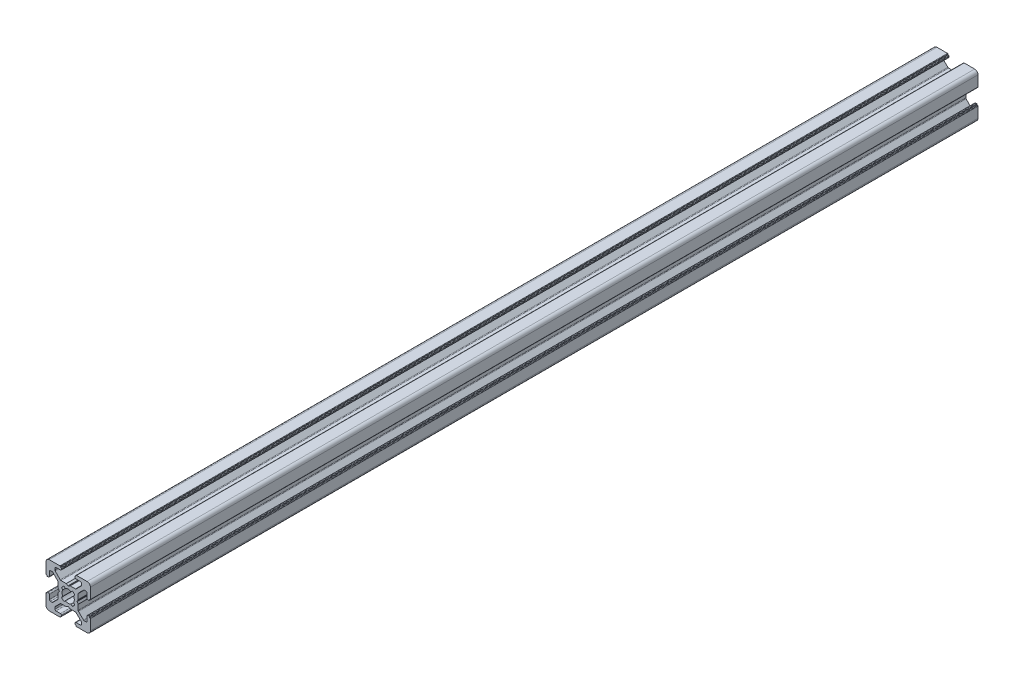
from build123d import *

# Parameters (mm, degrees)
EXTRUDE1_DEPTH = 400


with BuildPart() as part:
    # Sketch1 → Extrude1 (new body)
    with BuildSketch(Plane.XY):
        with BuildLine():
            Line((-3.5, 8.499999673), (-5.500000686, 8.499999673))
            ThreePointArc((-5.500000686, 8.499999673), (-5.853554077, 8.353553064), (-6.000000686, 7.999999673))
            Line((-6.000000686, 7.999999673), (-6.000000686, 7.267766626))
            ThreePointArc((-6.000000686, 7.267766626), (-5.961940448, 7.076424899), (-5.853554059, 6.914213219))
            Line((-5.853554059, 6.914213219), (-3.585787212, 4.646446592))
            ThreePointArc((-3.585787212, 4.646446592), (-3.423575544, 4.538060229), (-3.232233839, 4.5))
            Line((-3.232233839, 4.5), (-0.953590312, 4.5))
            ThreePointArc((-0.953590312, 4.5), (-0.901826505, 4.493185166), (-0.853590316, 4.473205083))
            Line((-0.853590316, 4.473205083), (-0.100000045, 4.038119562))
            ThreePointArc((-0.100000045, 4.038119562), (0, 4.011324632), (0.100000045, 4.038119562))
            Line((0.100000045, 4.038119562), (0.853590316, 4.473205083))
            ThreePointArc((0.853590316, 4.473205083), (0.901826505, 4.493185166), (0.953590312, 4.5))
            Line((0.953590312, 4.5), (3.232233839, 4.5))
            ThreePointArc((3.232233839, 4.5), (3.423575544, 4.538060229), (3.585787212, 4.646446592))
            Line((3.585787212, 4.646446592), (5.853554059, 6.914213219))
            ThreePointArc((5.853554059, 6.914213219), (5.961940448, 7.076424899), (6.000000686, 7.267766626))
            Line((6.000000686, 7.267766626), (6.000000686, 7.999999673))
            ThreePointArc((6.000000686, 7.999999673), (5.853554077, 8.353553064), (5.500000686, 8.499999673))
            Line((5.500000686, 8.499999673), (3.5, 8.499999673))
            ThreePointArc((3.5, 8.499999673), (3.146446609, 8.646446283), (3, 8.999999673))
            Line((3, 8.999999673), (3, 9.3))
            ThreePointArc((3, 9.3), (3.058578644, 9.441421356), (3.2, 9.5))
            Line((3.2, 9.5), (3.350000228, 9.5))
            ThreePointArc((3.350000228, 9.5), (3.491421584, 9.558578644), (3.550000228, 9.7))
            Line((3.550000228, 9.7), (3.550000228, 9.8))
            ThreePointArc((3.550000228, 9.8), (3.608578871, 9.941421356), (3.750000228, 10))
            Line((3.750000228, 10), (8.5, 10))
            ThreePointArc((8.5, 10), (9.560660172, 9.560660172), (10, 8.5))
            Line((10, 8.5), (10, 3.749999605))
            ThreePointArc((10, 3.749999605), (9.941421356, 3.608578248), (9.8, 3.549999605))
            Line((9.8, 3.549999605), (9.699999732, 3.549999605))
            ThreePointArc((9.699999732, 3.549999605), (9.558578376, 3.491420961), (9.499999732, 3.349999605))
            Line((9.499999732, 3.349999605), (9.499999732, 3.2))
            ThreePointArc((9.499999732, 3.2), (9.441421088, 3.058578644), (9.299999732, 3))
            Line((9.299999732, 3), (8.999999732, 3))
            ThreePointArc((8.999999732, 3), (8.646446341, 3.146446609), (8.499999732, 3.5))
            Line((8.499999732, 3.5), (8.499999732, 5.499999605))
            ThreePointArc((8.499999732, 5.499999605), (8.353553123, 5.853552995), (7.999999732, 5.999999605))
            Line((7.999999732, 5.999999605), (7.267766685, 5.999999605))
            ThreePointArc((7.267766685, 5.999999605), (7.076424969, 5.961939371), (6.914213294, 5.853552995))
            Line((6.914213294, 5.853552995), (4.646446398, 3.585786099))
            ThreePointArc((4.646446398, 3.585786099), (4.538060023, 3.423574425), (4.499999789, 3.232232708))
            Line((4.499999789, 3.232232708), (4.499999789, 0.953589302))
            ThreePointArc((4.499999789, 0.953589302), (4.493184953, 0.90182549), (4.473204867, 0.853589297))
            Line((4.473204867, 0.853589297), (4.038119841, 0.099999969))
            ThreePointArc((4.038119841, 0.099999969), (4.011324929, 0), (4.038119841, -0.099999969))
            Line((4.038119841, -0.099999969), (4.473204867, -0.853589297))
            ThreePointArc((4.473204867, -0.853589297), (4.493184953, -0.90182549), (4.499999789, -0.953589302))
            Line((4.499999789, -0.953589302), (4.499999789, -3.232232708))
            ThreePointArc((4.499999789, -3.232232708), (4.538060023, -3.423574425), (4.646446398, -3.585786099))
            Line((4.646446398, -3.585786099), (6.914213294, -5.853552995))
            ThreePointArc((6.914213294, -5.853552995), (7.076424969, -5.961939371), (7.267766685, -5.999999605))
            Line((7.267766685, -5.999999605), (7.999999732, -5.999999605))
            ThreePointArc((7.999999732, -5.999999605), (8.353553123, -5.853552995), (8.499999732, -5.499999605))
            Line((8.499999732, -5.499999605), (8.499999732, -3.5))
            ThreePointArc((8.499999732, -3.5), (8.646446341, -3.146446609), (8.999999732, -3))
            Line((8.999999732, -3), (9.299999732, -3))
            ThreePointArc((9.299999732, -3), (9.441421088, -3.058578644), (9.499999732, -3.2))
            Line((9.499999732, -3.2), (9.499999732, -3.349999605))
            ThreePointArc((9.499999732, -3.349999605), (9.558578376, -3.491420961), (9.699999732, -3.549999605))
            Line((9.699999732, -3.549999605), (9.8, -3.549999605))
            ThreePointArc((9.8, -3.549999605), (9.941421356, -3.608578248), (10, -3.749999605))
            Line((10, -3.749999605), (10, -8.5))
            ThreePointArc((10, -8.5), (9.560660172, -9.560660172), (8.5, -10))
            Line((8.5, -10), (3.750000228, -10))
            ThreePointArc((3.750000228, -10), (3.608578871, -9.941421356), (3.550000228, -9.8))
            Line((3.550000228, -9.8), (3.550000228, -9.7))
            ThreePointArc((3.550000228, -9.7), (3.491421584, -9.558578644), (3.350000228, -9.5))
            Line((3.350000228, -9.5), (3.2, -9.5))
            ThreePointArc((3.2, -9.5), (3.058578644, -9.441421356), (3, -9.3))
            Line((3, -9.3), (3, -8.999999673))
            ThreePointArc((3, -8.999999673), (3.146446609, -8.646446283), (3.5, -8.499999673))
            Line((3.5, -8.499999673), (5.500000686, -8.499999673))
            ThreePointArc((5.500000686, -8.499999673), (5.853554077, -8.353553064), (6.000000686, -7.999999673))
            Line((6.000000686, -7.999999673), (6.000000686, -7.267766626))
            ThreePointArc((6.000000686, -7.267766626), (5.961940448, -7.076424899), (5.853554059, -6.914213219))
            Line((5.853554059, -6.914213219), (3.585787212, -4.646446592))
            ThreePointArc((3.585787212, -4.646446592), (3.423575544, -4.538060229), (3.232233839, -4.5))
            Line((3.232233839, -4.5), (0.953590312, -4.5))
            ThreePointArc((0.953590312, -4.5), (0.901826505, -4.493185166), (0.853590316, -4.473205083))
            Line((0.853590316, -4.473205083), (0.100000045, -4.038119562))
            ThreePointArc((0.100000045, -4.038119562), (0, -4.011324632), (-0.100000045, -4.038119562))
            Line((-0.100000045, -4.038119562), (-0.853590316, -4.473205083))
            ThreePointArc((-0.853590316, -4.473205083), (-0.901826505, -4.493185166), (-0.953590312, -4.5))
            Line((-0.953590312, -4.5), (-3.232233839, -4.5))
            ThreePointArc((-3.232233839, -4.5), (-3.423575544, -4.538060229), (-3.585787212, -4.646446592))
            Line((-3.585787212, -4.646446592), (-5.853554059, -6.914213219))
            ThreePointArc((-5.853554059, -6.914213219), (-5.961940448, -7.076424899), (-6.000000686, -7.267766626))
            Line((-6.000000686, -7.267766626), (-6.000000686, -7.999999673))
            ThreePointArc((-6.000000686, -7.999999673), (-5.853554077, -8.353553064), (-5.500000686, -8.499999673))
            Line((-5.500000686, -8.499999673), (-3.5, -8.499999673))
            ThreePointArc((-3.5, -8.499999673), (-3.146446609, -8.646446283), (-3, -8.999999673))
            Line((-3, -8.999999673), (-3, -9.3))
            ThreePointArc((-3, -9.3), (-3.058578644, -9.441421356), (-3.2, -9.5))
            Line((-3.2, -9.5), (-3.350000228, -9.5))
            ThreePointArc((-3.350000228, -9.5), (-3.491421584, -9.558578644), (-3.550000228, -9.7))
            Line((-3.550000228, -9.7), (-3.550000228, -9.8))
            ThreePointArc((-3.550000228, -9.8), (-3.608578871, -9.941421356), (-3.750000228, -10))
            Line((-3.750000228, -10), (-8.5, -10))
            ThreePointArc((-8.5, -10), (-9.560660172, -9.560660172), (-10, -8.5))
            Line((-10, -8.5), (-10, -3.749999605))
            ThreePointArc((-10, -3.749999605), (-9.941421356, -3.608578248), (-9.8, -3.549999605))
            Line((-9.8, -3.549999605), (-9.699999732, -3.549999605))
            ThreePointArc((-9.699999732, -3.549999605), (-9.558578376, -3.491420961), (-9.499999732, -3.349999605))
            Line((-9.499999732, -3.349999605), (-9.499999732, -3.2))
            ThreePointArc((-9.499999732, -3.2), (-9.441421088, -3.058578644), (-9.299999732, -3))
            Line((-9.299999732, -3), (-8.999999732, -3))
            ThreePointArc((-8.999999732, -3), (-8.646446341, -3.146446609), (-8.499999732, -3.5))
            Line((-8.499999732, -3.5), (-8.499999732, -5.499999605))
            ThreePointArc((-8.499999732, -5.499999605), (-8.353553123, -5.853552995), (-7.999999732, -5.999999605))
            Line((-7.999999732, -5.999999605), (-7.267766685, -5.999999605))
            ThreePointArc((-7.267766685, -5.999999605), (-7.076424969, -5.961939371), (-6.914213294, -5.853552995))
            Line((-6.914213294, -5.853552995), (-4.646446398, -3.585786099))
            ThreePointArc((-4.646446398, -3.585786099), (-4.538060023, -3.423574425), (-4.499999789, -3.232232708))
            Line((-4.499999789, -3.232232708), (-4.499999789, -0.953589302))
            ThreePointArc((-4.499999789, -0.953589302), (-4.493184953, -0.90182549), (-4.473204867, -0.853589297))
            Line((-4.473204867, -0.853589297), (-4.038119841, -0.099999969))
            ThreePointArc((-4.038119841, -0.099999969), (-4.011324929, 0), (-4.038119841, 0.099999969))
            Line((-4.038119841, 0.099999969), (-4.473204867, 0.853589297))
            ThreePointArc((-4.473204867, 0.853589297), (-4.493184953, 0.90182549), (-4.499999789, 0.953589302))
            Line((-4.499999789, 0.953589302), (-4.499999789, 3.232232708))
            ThreePointArc((-4.499999789, 3.232232708), (-4.538060023, 3.423574425), (-4.646446398, 3.585786099))
            Line((-4.646446398, 3.585786099), (-6.914213294, 5.853552995))
            ThreePointArc((-6.914213294, 5.853552995), (-7.076424969, 5.961939371), (-7.267766685, 5.999999605))
            Line((-7.267766685, 5.999999605), (-7.999999732, 5.999999605))
            ThreePointArc((-7.999999732, 5.999999605), (-8.353553123, 5.853552995), (-8.499999732, 5.499999605))
            Line((-8.499999732, 5.499999605), (-8.499999732, 3.5))
            ThreePointArc((-8.499999732, 3.5), (-8.646446341, 3.146446609), (-8.999999732, 3))
            Line((-8.999999732, 3), (-9.299999732, 3))
            ThreePointArc((-9.299999732, 3), (-9.441421088, 3.058578644), (-9.499999732, 3.2))
            Line((-9.499999732, 3.2), (-9.499999732, 3.349999605))
            ThreePointArc((-9.499999732, 3.349999605), (-9.558578376, 3.491420961), (-9.699999732, 3.549999605))
            Line((-9.699999732, 3.549999605), (-9.8, 3.549999605))
            ThreePointArc((-9.8, 3.549999605), (-9.941421356, 3.608578248), (-10, 3.749999605))
            Line((-10, 3.749999605), (-10, 8.5))
            ThreePointArc((-10, 8.5), (-9.560660172, 9.560660172), (-8.5, 10))
            Line((-8.5, 10), (-3.750000228, 10))
            ThreePointArc((-3.750000228, 10), (-3.608578871, 9.941421356), (-3.550000228, 9.8))
            Line((-3.550000228, 9.8), (-3.550000228, 9.7))
            ThreePointArc((-3.550000228, 9.7), (-3.491421584, 9.558578644), (-3.350000228, 9.5))
            Line((-3.350000228, 9.5), (-3.2, 9.5))
            ThreePointArc((-3.2, 9.5), (-3.058578644, 9.441421356), (-3, 9.3))
            Line((-3, 9.3), (-3, 8.999999673))
            ThreePointArc((-3, 8.999999673), (-3.146446609, 8.646446283), (-3.5, 8.499999673))
        make_face()
        with BuildLine():
            Line((-1.258185436, 2.445295362), (-1.91389502, 2.989640962))
            ThreePointArc((-1.91389502, 2.989640962), (-2.511737261, 2.508410485), (-2.992174953, 1.909930962))
            Line((-2.992174953, 1.909930962), (-2.445295423, 1.258185317))
            ThreePointArc((-2.445295423, 1.258185317), (-2.75, 0), (-2.445295423, -1.258185317))
            Line((-2.445295423, -1.258185317), (-2.992174953, -1.909930962))
            ThreePointArc((-2.992174953, -1.909930962), (-2.511737261, -2.508410485), (-1.91389502, -2.989640962))
            Line((-1.91389502, -2.989640962), (-1.258185436, -2.445295362))
            ThreePointArc((-1.258185436, -2.445295362), (0, -2.75), (1.258185436, -2.445295362))
            Line((1.258185436, -2.445295362), (1.91389502, -2.989640962))
            ThreePointArc((1.91389502, -2.989640962), (2.511737261, -2.508410485), (2.992174953, -1.909930962))
            Line((2.992174953, -1.909930962), (2.445295423, -1.258185317))
            ThreePointArc((2.445295423, -1.258185317), (2.75, 0), (2.445295423, 1.258185317))
            Line((2.445295423, 1.258185317), (2.992174953, 1.909930962))
            ThreePointArc((2.992174953, 1.909930962), (2.511737261, 2.508410485), (1.91389502, 2.989640962))
            Line((1.91389502, 2.989640962), (1.258185436, 2.445295362))
            ThreePointArc((1.258185436, 2.445295362), (0, 2.75), (-1.258185436, 2.445295362))
        make_face(mode=Mode.SUBTRACT)
    extrude(amount=EXTRUDE1_DEPTH)


solid = part.part
